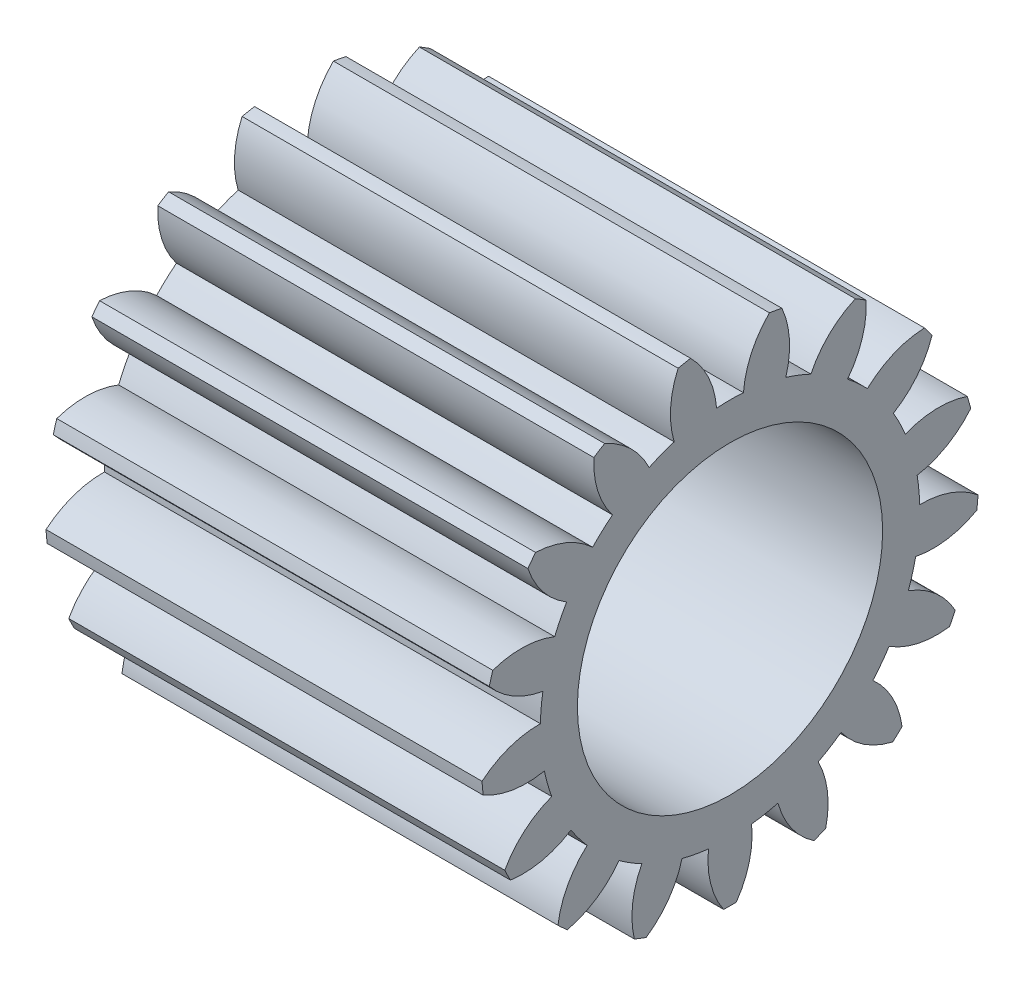
from build123d import *

# Parameters (mm, degrees)
BASPROSKE_W     = 50
BASPROSKE_H     = 28.5
TOOTHCUT_DEPTH  = 65.222270281
TEETHCUTS_COUNT = 17
TEETHCUTS_ANGLE = 338.823529412
BORSKE_R        = 17.5
BORE_DEPTH      = 50.0000508


with BuildPart() as part:
    # BasProSke → Base-Revolve (revolve)
    with BuildSketch(Plane(origin=(0, 0, 0), x_dir=(1, 0, 0), z_dir=(0, 1, 0)), mode=Mode.PRIVATE) as base_revolve_sk:
        with Locations((25, 14.25)):
            Rectangle(BASPROSKE_W, BASPROSKE_H)
    revolve(base_revolve_sk.sketch.rotate(Axis((-10, 0, 0), (1, 0, 0)), 180), axis=Axis((-10, 0, 0), (1, 0, 0)))

    # TooCutSke → ToothCut (cut, through all)
    with BuildSketch(Plane(origin=(0, 0, 0), x_dir=(0, 0, -1), z_dir=(1, 0, 0))):
        with BuildLine():
            ThreePointArc((1.540279816, 21.694389576), (0, 21.749), (-1.540279816, 21.694389576))
            ThreePointArc((-1.540279816, 21.694389576), (-2.457007956, 25.198716871), (-4.540621854, 28.161697363))
            ThreePointArc((-4.540621854, 28.161697363), (0, 28.5254), (4.540621854, 28.161697363))
            ThreePointArc((4.540621854, 28.161697363), (2.457007956, 25.198716871), (1.540279816, 21.694389576))
        make_face()
    toothcut = extrude(amount=TOOTHCUT_DEPTH, mode=Mode.SUBTRACT)

    # TeethCuts: ToothCut ×17 about axis
    teethcuts_axis = Axis((-10, 0, 0), (1, 0, 0))
    for i in range(1, TEETHCUTS_COUNT):
        add(toothcut.rotate(teethcuts_axis, i * TEETHCUTS_ANGLE / (TEETHCUTS_COUNT - 1)), mode=Mode.SUBTRACT)

    # BorSke → Bore (cut, symmetric)
    with BuildSketch(Plane(origin=(0, 0, 0), x_dir=(0, 0, -1), z_dir=(1, 0, 0))):
        with Locations(Location((0, 0, 0), (0, 0, 180))):
            Circle(BORSKE_R)
    extrude(amount=BORE_DEPTH, both=True, mode=Mode.SUBTRACT)


solid = part.part
